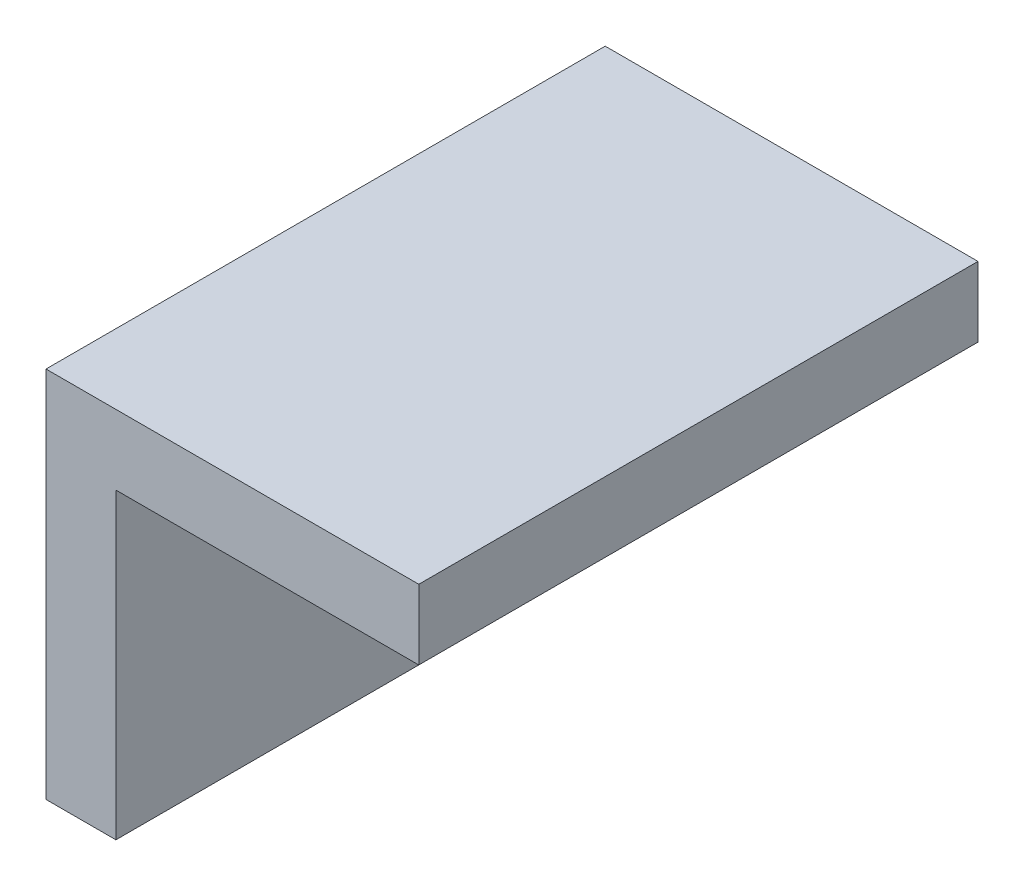
from build123d import *

# Parameters (mm, degrees)
SALIENTE_EXTRUIR1_DEPTH = 76.2


with BuildPart() as part:
    # Croquis1 → Saliente-Extruir1 (new body)
    with BuildSketch(Plane.XY):
        Polygon((0, 0), (0, -50.8), (9.525, -50.8), (9.525, -9.525), (50.8, -9.525), (50.8, 0), align=None)
    extrude(amount=SALIENTE_EXTRUIR1_DEPTH)


solid = part.part
